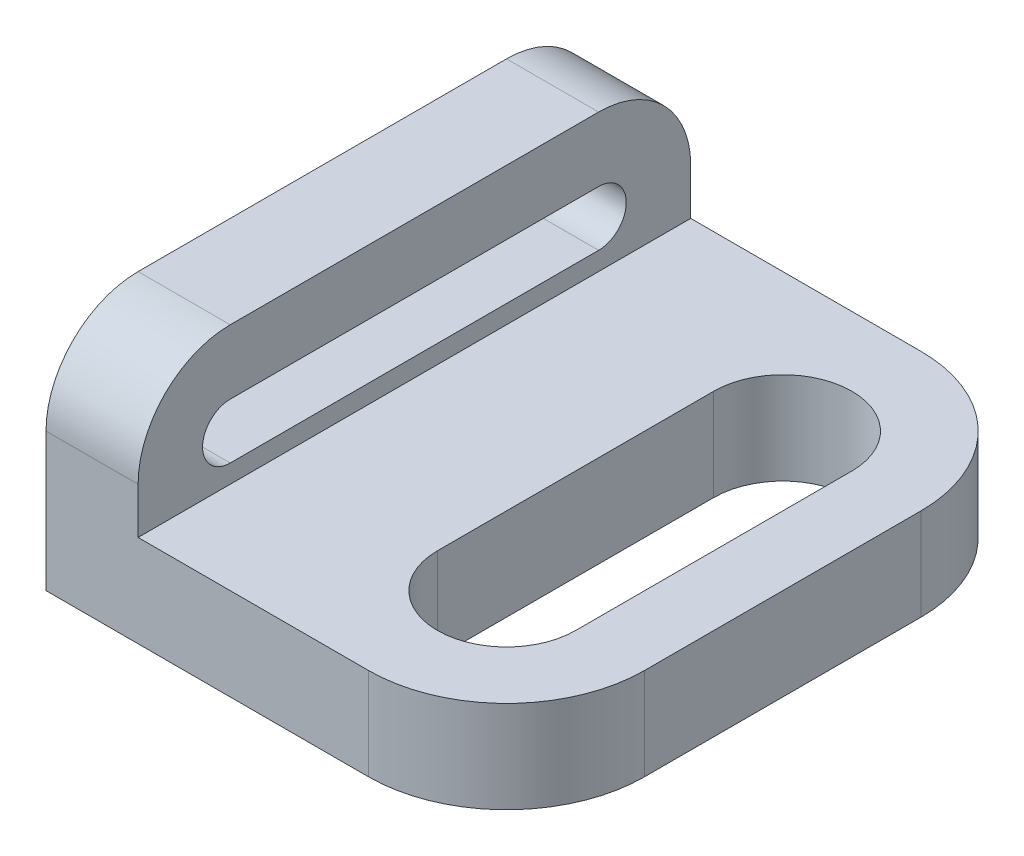
from build123d import *

# Parameters (mm, degrees)
BOSS_EXTRUDE1_DEPTH = 10
BOSS_EXTRUDE2_DEPTH = 20


with BuildPart() as part:
    # Sketch1 → Boss-Extrude1 (new, symmetric)
    with BuildSketch(Plane(origin=(0, 0, 0), x_dir=(0, 0, -1), z_dir=(1, 0, 0))):
        with BuildLine():
            Line((-60, 0), (60, 0))
            Line((60, 0), (60, 30))
            ThreePointArc((60, 30), (54.142135624, 44.142135624), (40, 50))
            Line((40, 50), (-40, 50))
            ThreePointArc((-40, 50), (-54.142135624, 44.142135624), (-60, 30))
            Line((-60, 30), (-60, 0))
        make_face()
        with BuildLine():
            Line((-40, 36), (40, 36))
            ThreePointArc((40, 36), (46, 30), (40, 24))
            Line((40, 24), (-40, 24))
            ThreePointArc((-40, 24), (-46, 30), (-40, 36))
        make_face(mode=Mode.SUBTRACT)
    extrude(amount=BOSS_EXTRUDE1_DEPTH, both=True)

    # Sketch2 → Boss-Extrude2 (add)
    with BuildSketch(Plane.XZ):
        with BuildLine():
            Line((10, -60), (60, -60))
            ThreePointArc((60, -60), (81.213203436, -51.213203436), (90, -30))
            Line((90, -30), (90, 30))
            ThreePointArc((90, 30), (81.213203436, 51.213203436), (60, 60))
            Line((60, 60), (10, 60))
            Line((10, 60), (10, -60))
        make_face()
        with BuildLine():
            Line((45, -30), (45, 30))
            ThreePointArc((45, 30), (60, 45), (75, 30))
            Line((75, 30), (75, -30))
            ThreePointArc((75, -30), (60, -45), (45, -30))
        make_face(mode=Mode.SUBTRACT)
    extrude(amount=-BOSS_EXTRUDE2_DEPTH)


solid = part.part
